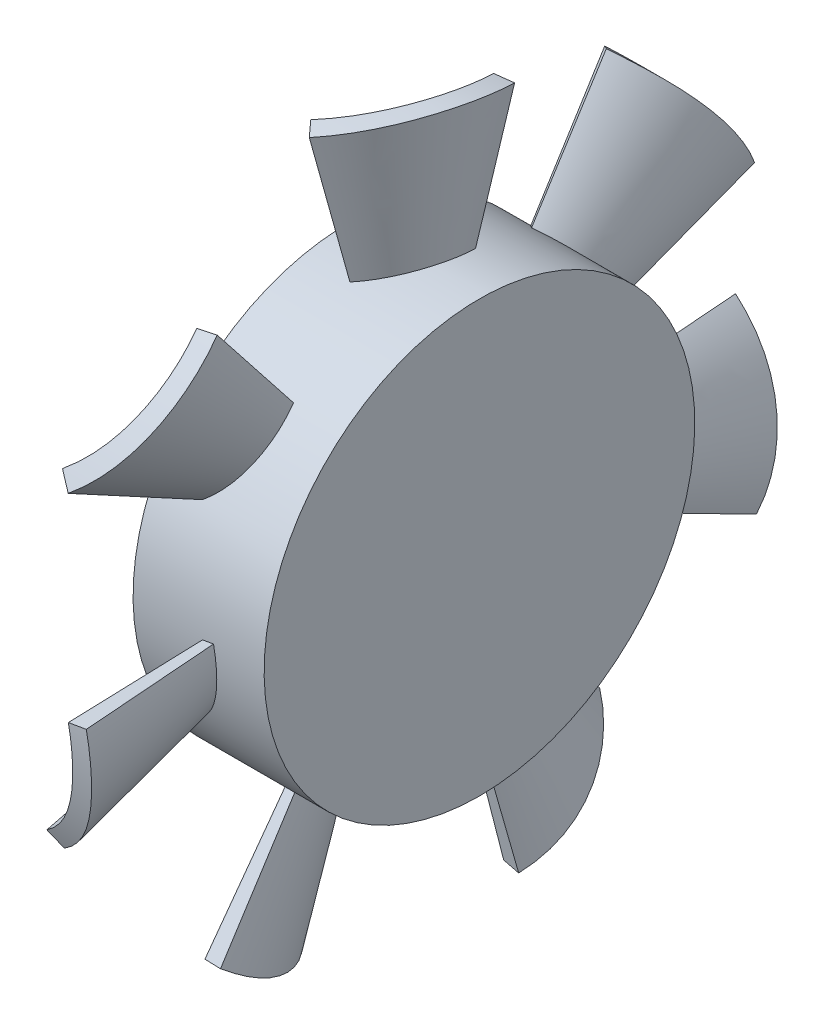
from build123d import *

# Parameters (mm, degrees)
SKETCH5_W                  = 7
SKETCH5_H                  = 11.5
CIRPATTERN1_COUNT          = 7
SKETCH_CUT_BLADE_OUTSIDE_W = 51.332
SKETCH_CUT_BLADE_OUTSIDE_H = 50.393
SKETCH_CUT_BLADE_OUTSIDE_R = 18.8
CUT_FAN_BLADE_DEPTH        = 29.710349676


with BuildPart() as part:
    # Sketch5 → Body (revolve)
    with BuildSketch(Plane.XY, mode=Mode.PRIVATE) as body_sk:
        with Locations((-6.5, 5.75)):
            Rectangle(SKETCH5_W, SKETCH5_H)
    revolve(body_sk.sketch.rotate(Axis((-10, 0, 0), (1, 0, 0)), 180), axis=Axis((-10, 0, 0), (1, 0, 0)))

    # Sketch-Blade-Top → Loft-Fan-Blade section 0
    with BuildSketch(Plane(origin=(0, 18.8, 0), x_dir=(-1, 0, 0), z_dir=(0, 1, 0)), mode=Mode.PRIVATE) as loft_fan_blade_s0:
        with BuildLine():
            Line((8.802929498, 3.288924173), (8.160141889, 4.054968616))
            ThreePointArc((8.160141889, 4.054968616), (5.560307379, 0.342020143), (5.165258885, -4.173404812))
            Line((5.165258885, -4.173404812), (6.150066638, -3.999756634))
            ThreePointArc((6.150066638, -3.999756634), (6.5, 0), (8.802929498, 3.288924173))
        make_face()
    loft_fan_blade = loft([loft_fan_blade_s0.sketch, Vertex(-6.5, 0, 0)])

    # CirPattern1: Loft-Fan-Blade ×7 about axis
    cirpattern1_axis = Axis((-10, 0, 0), (1, 0, 0))
    for i in range(1, CIRPATTERN1_COUNT):
        add(loft_fan_blade.rotate(cirpattern1_axis, i * 360 / CIRPATTERN1_COUNT))

    # Sketch-Cut-Blade outside → Cut-Fan-Blade (cut, through all)
    with BuildSketch(Plane(origin=(0, 0, 0), x_dir=(0, 0, -1), z_dir=(1, 0, 0))):
        with Locations((-0.013, 0.0255)):
            Rectangle(SKETCH_CUT_BLADE_OUTSIDE_W, SKETCH_CUT_BLADE_OUTSIDE_H)
        Circle(SKETCH_CUT_BLADE_OUTSIDE_R, mode=Mode.SUBTRACT)
    extrude(amount=-CUT_FAN_BLADE_DEPTH, mode=Mode.SUBTRACT)


solid = part.part
